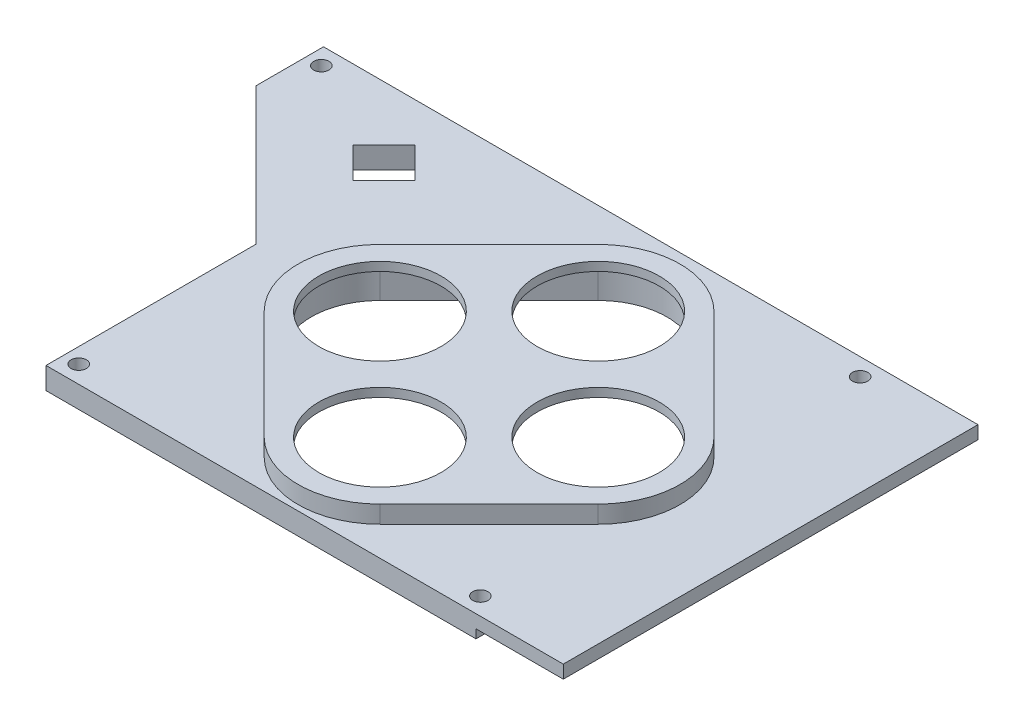
from build123d import *

# Parameters (mm, degrees)
SKETCH1_W           = 200
SKETCH1_H           = 95
SKETCH1_R           = 1.75
BOSS_EXTRUDE1_DEPTH = 5
SKETCH2_R           = 15.75
SKETCH2_R_2         = 12.5
CUT_EXTRUDE1_DEPTH  = 5
SKETCH4_W           = 16
SKETCH4_H           = 37
BOSS_EXTRUDE2_DEPTH = 4.2
SKETCH6_W           = 20
SKETCH6_H           = 95
BOSS_EXTRUDE3_DEPTH = 3
BOSS_EXTRUDE4_START = 4
BOSS_EXTRUDE4_DEPTH = 4
SKETCH9_R           = 14
BOSS_EXTRUDE5_DEPTH = 2
CUT_EXTRUDE2_DEPTH  = 5
SKETCH11_R          = 1.75
CUT_EXTRUDE3_DEPTH  = 10
SKETCH14_R          = 1.75
SKETCH14_R_2        = 12.5
CUT_EXTRUDE4_DEPTH  = 10
CUT_EXTRUDE5_DEPTH  = 5


with BuildPart() as part:
    # Sketch1 → Boss-Extrude1 (new body)
    with BuildSketch(Plane(origin=(0, 0, 0), x_dir=(1, 0, 0), z_dir=(0, 1, 0))):
        Rectangle(SKETCH1_W, SKETCH1_H)
        with Locations(Location((-96, 43.5, 0), (0, 0, 270))):
            Circle(SKETCH1_R, mode=Mode.SUBTRACT)
        with Locations(Location((-96, -43.5, 0), (0, 0, 270))):
            Circle(SKETCH1_R, mode=Mode.SUBTRACT)
        with Locations(Location((97, 43.5, 0), (0, 0, 270))):
            Circle(SKETCH1_R, mode=Mode.SUBTRACT)
        with Locations(Location((97, -43.5, 0), (0, 0, 270))):
            Circle(SKETCH1_R, mode=Mode.SUBTRACT)
    extrude(amount=BOSS_EXTRUDE1_DEPTH)

    # Sketch2 → Cut-Extrude1 (cut)
    with BuildSketch(Plane(origin=(0, 5, 0), x_dir=(1, 0, 0), z_dir=(0, 1, 0))):
        with Locations((33, -2.5)):
            Circle(SKETCH2_R)
        with BuildLine():
            ThreePointArc((48.75, -2.5), (39.02726406, -17.051102637), (21.863068196, -13.636931804))
            Line((21.863068196, -13.636931804), (46.863068196, -38.636931804))
            ThreePointArc((46.863068196, -38.636931804), (51.97273594, -12.948897363), (73.75, -27.5))
            ThreePointArc((73.75, -27.5), (72.551102637, -33.52726406), (69.136931804, -38.636931804))
            Line((69.136931804, -38.636931804), (94.136931804, -13.636931804))
            ThreePointArc((94.136931804, -13.636931804), (67.25, -2.5), (94.136931804, 8.636931804))
            Line((94.136931804, 8.636931804), (69.136931804, 33.636931804))
            ThreePointArc((69.136931804, 33.636931804), (72.551102637, 28.52726406), (73.75, 22.5))
            ThreePointArc((73.75, 22.5), (51.97273594, 7.948897363), (46.863068196, 33.636931804))
            Line((46.863068196, 33.636931804), (21.863068196, 8.636931804))
            ThreePointArc((21.863068196, 8.636931804), (39.02726406, 12.051102637), (48.75, -2.5))
        make_face()
        with Locations((58, -27.5)):
            Circle(SKETCH2_R)
        with Locations((83, -2.5)):
            Circle(SKETCH2_R)
        with Locations((58, 22.5)):
            Circle(SKETCH2_R)
        with Locations(Location((-82, -27.5, 0), (0, 0, 270))):
            Circle(SKETCH2_R_2)
    extrude(amount=-CUT_EXTRUDE1_DEPTH, mode=Mode.SUBTRACT)

    # Sketch4 → Boss-Extrude2 (add)
    with BuildSketch(Plane.XZ):
        with Locations((-82.5, -19.5)):
            Rectangle(SKETCH4_W, SKETCH4_H)
    extrude(amount=BOSS_EXTRUDE2_DEPTH)

    # Sketch6 → Boss-Extrude3 (add)
    with BuildSketch(Plane(origin=(0, 5, 0), x_dir=(1, 0, 0), z_dir=(0, 1, 0))):
        with Locations((-110, 0)):
            Rectangle(SKETCH6_W, SKETCH6_H)
        with Locations((110, 0)):
            Rectangle(SKETCH6_W, SKETCH6_H)
    extrude(amount=-BOSS_EXTRUDE3_DEPTH)

    # Sketch8 → Boss-Extrude4 (add)
    with BuildSketch(Plane(origin=(0, 5, 0), x_dir=(1, 0, 0), z_dir=(0, 1, 0)).offset(BOSS_EXTRUDE4_START)):
        with BuildLine():
            Line((71.258252147, -40.758252147), (96.258252147, -15.758252147))
            ThreePointArc((96.258252147, -15.758252147), (101.75, -2.5), (96.258252147, 10.758252147))
            Line((96.258252147, 10.758252147), (71.258252147, 35.758252147))
            ThreePointArc((71.258252147, 35.758252147), (58, 41.25), (44.741747853, 35.758252147))
            Line((44.741747853, 35.758252147), (19.741747853, 10.758252147))
            ThreePointArc((19.741747853, 10.758252147), (14.25, -2.5), (19.741747853, -15.758252147))
            Line((19.741747853, -15.758252147), (44.741747853, -40.758252147))
            ThreePointArc((44.741747853, -40.758252147), (58, -46.25), (71.258252147, -40.758252147))
        make_face()
        with BuildLine():
            Line((21.863068196, -13.636931804), (46.863068196, -38.636931804))
            ThreePointArc((46.863068196, -38.636931804), (58, -43.25), (69.136931804, -38.636931804))
            Line((69.136931804, -38.636931804), (94.136931804, -13.636931804))
            ThreePointArc((94.136931804, -13.636931804), (98.75, -2.5), (94.136931804, 8.636931804))
            Line((94.136931804, 8.636931804), (69.136931804, 33.636931804))
            ThreePointArc((69.136931804, 33.636931804), (58, 38.25), (46.863068196, 33.636931804))
            Line((46.863068196, 33.636931804), (21.863068196, 8.636931804))
            ThreePointArc((21.863068196, 8.636931804), (17.25, -2.5), (21.863068196, -13.636931804))
        make_face(mode=Mode.SUBTRACT)
    extrude(amount=-BOSS_EXTRUDE4_DEPTH)

    # Sketch9 → Boss-Extrude5 (add)
    with BuildSketch(Plane(origin=(0, 9, 0), x_dir=(1, 0, 0), z_dir=(0, 1, 0))):
        with BuildLine():
            Line((21.863068196, -13.636931804), (46.863068196, -38.636931804))
            ThreePointArc((46.863068196, -38.636931804), (58, -43.25), (69.136931804, -38.636931804))
            Line((69.136931804, -38.636931804), (94.136931804, -13.636931804))
            ThreePointArc((94.136931804, -13.636931804), (98.75, -2.5), (94.136931804, 8.636931804))
            Line((94.136931804, 8.636931804), (69.136931804, 33.636931804))
            ThreePointArc((69.136931804, 33.636931804), (58, 38.25), (46.863068196, 33.636931804))
            Line((46.863068196, 33.636931804), (21.863068196, 8.636931804))
            ThreePointArc((21.863068196, 8.636931804), (17.25, -2.5), (21.863068196, -13.636931804))
        make_face()
        with Locations(Location((58, 22.5, 0), (0, 0, 270))):
            Circle(SKETCH9_R, mode=Mode.SUBTRACT)
        with Locations(Location((83, -2.5, 0), (0, 0, 270))):
            Circle(SKETCH9_R, mode=Mode.SUBTRACT)
        with Locations(Location((58, -27.5, 0), (0, 0, 270))):
            Circle(SKETCH9_R, mode=Mode.SUBTRACT)
        with Locations(Location((33, -2.5, 0), (0, 0, 270))):
            Circle(SKETCH9_R, mode=Mode.SUBTRACT)
    extrude(amount=-BOSS_EXTRUDE5_DEPTH)

    # Sketch10 → Cut-Extrude2 (cut)
    with BuildSketch(Plane(origin=(0, 5, 0), x_dir=(1, 0, 0), z_dir=(0, 1, 0))):
        Polygon((0, 38.5), (-7.071067812, 31.428932188), (0, 24.357864376), (7.071067812, 31.428932188), align=None)
    extrude(amount=-CUT_EXTRUDE2_DEPTH, mode=Mode.SUBTRACT)

    # Sketch11 → Cut-Extrude3 (cut)
    with BuildSketch(Plane(origin=(0, 5, 0), x_dir=(1, 0, 0), z_dir=(0, 1, 0))):
        with Locations(Location((-36.428932188, 43.5, 0), (0, 0, 270))):
            Circle(SKETCH11_R)
        with Locations(Location((-26.428932188, 43.5, 0), (0, 0, 270))):
            Circle(SKETCH11_R)
        with Locations(Location((5, -43.5, 0), (0, 0, 270))):
            Circle(SKETCH11_R)
        with Locations(Location((-5, -43.5, 0), (0, 0, 270))):
            Circle(SKETCH11_R)
    extrude(amount=-CUT_EXTRUDE3_DEPTH, mode=Mode.SUBTRACT)

    # Sketch14 → Cut-Extrude4 (cut)
    # profile 1 of 2: a face of its own
    with BuildSketch(Plane(origin=(0, 5, 0), x_dir=(1, 0, 0), z_dir=(0, 1, 0))):
        Polygon((0, 0), (-31.428932188, 31.428932188), (-31.428932188, 47.5), (-120, 47.5), (-120, -47.5), (0, -47.5), align=None)
        with Locations((-96, -43.5)):
            Circle(SKETCH14_R, mode=Mode.SUBTRACT)
        with Locations((-82, -27.5)):
            Circle(SKETCH14_R_2, mode=Mode.SUBTRACT)
        with Locations((-5, -43.5)):
            Circle(SKETCH14_R, mode=Mode.SUBTRACT)
        with Locations((-96, 43.5)):
            Circle(SKETCH14_R, mode=Mode.SUBTRACT)
        with Locations((-36.428932188, 43.5)):
            Circle(SKETCH14_R, mode=Mode.SUBTRACT)
    # profile 2 of 2: a face of its own
    with BuildSketch(Plane(origin=(0, 5, 0), x_dir=(1, 0, 0), z_dir=(0, 1, 0))):
        with Locations((-82, -27.5)):
            Circle(SKETCH14_R_2)
    extrude(amount=-CUT_EXTRUDE4_DEPTH, mode=Mode.SUBTRACT)

    # Sketch15 → Cut-Extrude5 (cut)
    with BuildSketch(Plane(origin=(0, 5, 0), x_dir=(1, 0, 0), z_dir=(0, 1, 0))):
        Polygon((-29.928932188, 47.5), (-31.428932188, 47.5), (-31.428932188, 31.428932188), (0, 0), (0, -47.5), (1.5, -47.5), (1.5, 0.621320344), (-29.928932188, 32.050252532), align=None)
    extrude(amount=-CUT_EXTRUDE5_DEPTH, mode=Mode.SUBTRACT)


solid = part.part
